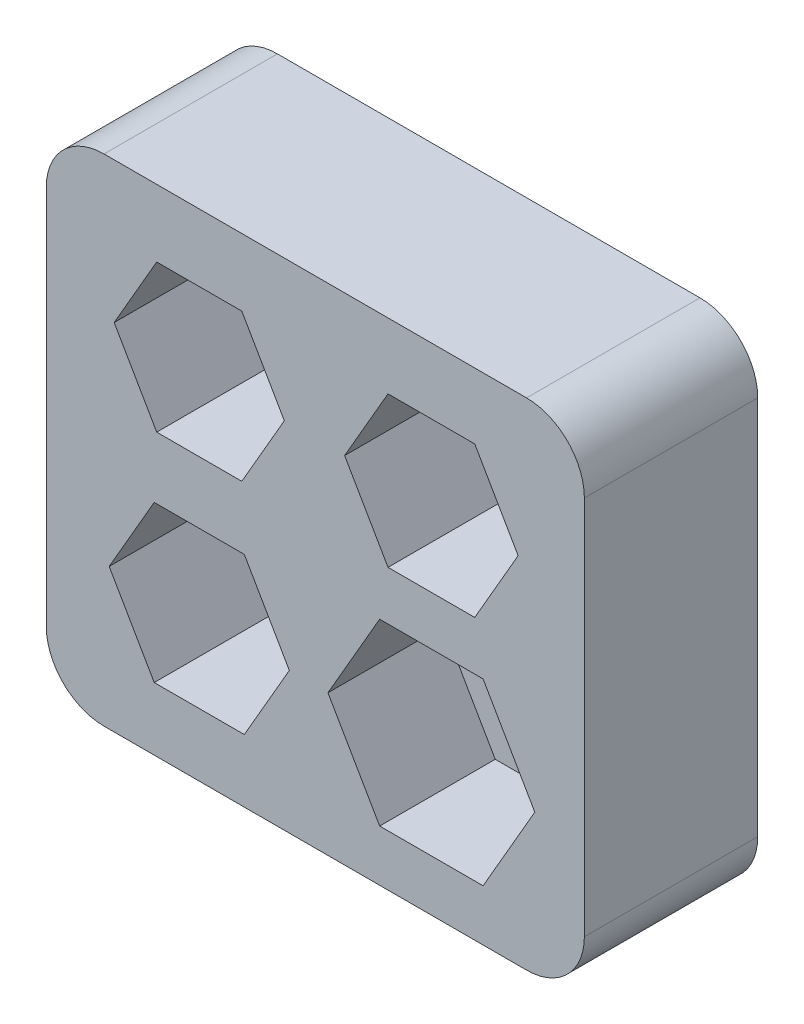
from build123d import *

# Parameters (mm, degrees)
SKETCH1_W           = 9.31161413
SKETCH1_H           = 8.575444948
BOSS_EXTRUDE1_DEPTH = 2
SKETCH2_W           = 9.31161413
SKETCH2_H           = 8.575444948
BOSS_EXTRUDE2_DEPTH = 1
CUT_EXTRUDE1_DEPTH  = 0.5
CUT_EXTRUDE2_DEPTH  = 0.5
FILLET1_R           = 1


with BuildPart() as part:
    # Sketch1 → Boss-Extrude1 (new body)
    with BuildSketch(Plane.XY):
        Rectangle(SKETCH1_W, SKETCH1_H)
        Polygon((-2.744413523, 3.124517886), (-3.480535116, 1.849517886), (-2.744413523, 0.574517886), (-1.272170336, 0.574517886), (-0.536048743, 1.849517886), (-1.272170336, 3.124517886), align=None, mode=Mode.SUBTRACT)
        Polygon((1.25773658, 3.149517886), (0.50718123, 1.849517886), (1.25773658, 0.549517886), (2.75884728, 0.549517886), (3.50940263, 1.849517886), (2.75884728, 3.149517886), align=None, mode=Mode.SUBTRACT)
        Polygon((-2.787714793, -0.499517886), (-3.567137657, -1.849517886), (-2.787714793, -3.199517886), (-1.228869066, -3.199517886), (-0.449446203, -1.849517886), (-1.228869066, -0.499517886), align=None, mode=Mode.SUBTRACT)
        Polygon((1.113399012, -0.299517886), (0.218506095, -1.849517886), (1.113399012, -3.399517886), (2.903184847, -3.399517886), (3.798077764, -1.849517886), (2.903184847, -0.299517886), align=None, mode=Mode.SUBTRACT)
    extrude(amount=BOSS_EXTRUDE1_DEPTH)

    # Sketch2 → Boss-Extrude2 (add)
    with BuildSketch(Plane(origin=(0, 0, 0), x_dir=(-1, 0, 0), z_dir=(0, 0, -1))):
        Rectangle(SKETCH2_W, SKETCH2_H)
    extrude(amount=BOSS_EXTRUDE2_DEPTH)

    # Sketch3 → Cut-Extrude1 (cut)
    # profile 1 of 7: a face of its own
    with BuildSketch(Plane.XY):
        with BuildLine():
            add(Edge.make_bspline(
                [(-2.692073578, 2.099317566), (-2.692026718, 2.107331478), (-2.691935692, 2.122898619), (-2.690923061, 2.145582139), (-2.689240869, 2.166862181), (-2.68693553, 2.186739761), (-2.684130104, 2.205220014), (-2.680385035, 2.22225355), (-2.676126063, 2.237919208), (-2.671189999, 2.252268072), (-2.665620315, 2.265493459), (-2.659558278, 2.277839916), (-2.652763307, 2.289288763), (-2.645623748, 2.300022733), (-2.637850595, 2.309866118), (-2.629665054, 2.318957927), (-2.620747643, 2.327088035), (-2.611401499, 2.334494649), (-2.601542004, 2.340987431), (-2.591450194, 2.346706394), (-2.581056608, 2.351592089), (-2.570332867, 2.35543358), (-2.559375359, 2.358606558), (-2.548145778, 2.360776407), (-2.536625583, 2.36214168), (-2.528849664, 2.362272204), (-2.52490611, 2.362338399)],
                knots=[0, 0, 0, 0, 1.646270934, 3.197905019, 4.663502075, 6.030701355, 7.308322542, 8.50163776, 9.611534131, 10.641858119, 11.616356847, 12.558055219, 13.465016945, 14.349605745, 15.204443733, 16.039544428, 16.859896111, 17.680448484, 18.487036065, 19.28249412, 20.06191084, 20.843045899, 21.620316918, 22.403196591, 23.190181807, 24, 24, 24, 24], degree=3))
            add(Edge.make_bspline(
                [(-2.52490611, 2.362338399), (-2.520929613, 2.362268711), (-2.513021612, 2.362130124), (-2.501330129, 2.360798132), (-2.489908746, 2.358587972), (-2.478806155, 2.355456404), (-2.467931157, 2.351571307), (-2.457368813, 2.346701719), (-2.447053516, 2.34103331), (-2.437149189, 2.334372756), (-2.427547101, 2.326946716), (-2.418483106, 2.318552049), (-2.40995638, 2.309273518), (-2.401859907, 2.299210395), (-2.394423394, 2.288169668), (-2.387341475, 2.276343367), (-2.381002612, 2.263524672), (-2.374897659, 2.249927462), (-2.369628089, 2.235175511), (-2.364875769, 2.219351974), (-2.361035916, 2.202269947), (-2.357837448, 2.184019055), (-2.355359606, 2.164532271), (-2.353554943, 2.143851369), (-2.352601645, 2.121962742), (-2.352422116, 2.106997335), (-2.352329988, 2.099317566)],
                knots=[0, 0, 0, 0, 0.810914788, 1.612654377, 2.396697861, 3.181598691, 3.963628158, 4.749916497, 5.551656086, 6.361998678, 7.18212741, 8.025565596, 8.878627764, 9.750805457, 10.657531673, 11.591944965, 12.560506719, 13.57287815, 14.630710178, 15.753379473, 16.941251878, 18.199788006, 19.531962791, 20.947069417, 22.433333509, 24, 24, 24, 24], degree=3))
            add(Edge.make_bspline(
                [(-2.352329988, 2.099317566), (-2.352423071, 2.091671293), (-2.352604441, 2.076772843), (-2.353544256, 2.054982704), (-2.355395489, 2.034411555), (-2.357711202, 2.01501006), (-2.360918482, 1.996858972), (-2.364862077, 1.979895479), (-2.369240695, 1.964046326), (-2.374645665, 1.949441353), (-2.380561481, 1.935876821), (-2.386997938, 1.923210086), (-2.393893627, 1.911329187), (-2.401406305, 1.900329223), (-2.409413936, 1.890132272), (-2.418087905, 1.880918326), (-2.427183703, 1.872465372), (-2.436814048, 1.864943711), (-2.446872841, 1.858360168), (-2.45715271, 1.852472475), (-2.46783605, 1.847724947), (-2.478680758, 1.843648513), (-2.489841953, 1.840534162), (-2.501305723, 1.838380754), (-2.513013757, 1.83687049), (-2.520928266, 1.836755279), (-2.52490611, 1.836697374)],
                knots=[0, 0, 0, 0, 1.561518951, 3.042555995, 4.452378317, 5.7783523, 7.031515105, 8.214008947, 9.334062868, 10.386615937, 11.391082383, 12.354592575, 13.286541444, 14.194233754, 15.072674879, 15.931287219, 16.775624067, 17.606195743, 18.42308326, 19.229000347, 20.022332153, 20.807536673, 21.593273796, 22.3848459, 23.188221202, 24, 24, 24, 24], degree=3))
            add(Edge.make_bspline(
                [(-2.52490611, 1.836697374), (-2.528849555, 1.836763996), (-2.536625258, 1.836895362), (-2.548147033, 1.838254466), (-2.559330239, 1.840439538), (-2.570230061, 1.843499053), (-2.580902421, 1.84724403), (-2.59120189, 1.852123127), (-2.601242988, 1.85774228), (-2.610998924, 1.864141626), (-2.620286376, 1.871473295), (-2.629157605, 1.879582479), (-2.637389751, 1.888671538), (-2.645051765, 1.898596955), (-2.652333777, 1.909267419), (-2.659032259, 1.920828615), (-2.665228095, 1.933234702), (-2.670891451, 1.946565832), (-2.675912689, 1.961016536), (-2.680348076, 1.976752133), (-2.683850098, 1.99391151), (-2.686847663, 2.012356848), (-2.689265432, 2.032167409), (-2.69091605, 2.053353949), (-2.691936238, 2.075903264), (-2.692026962, 2.091370375), (-2.692073578, 2.099317566)],
                knots=[0, 0, 0, 0, 0.810891512, 1.598919785, 2.382837074, 3.152667961, 3.926044502, 4.706494248, 5.493654104, 6.291793342, 7.103789334, 7.925228297, 8.761435821, 9.622817696, 10.50288917, 11.416980706, 12.369136599, 13.353924996, 14.394355917, 15.514179734, 16.714354668, 17.994756427, 19.357759367, 20.818452758, 22.365282078, 24, 24, 24, 24], degree=3))
        make_face()
        with BuildLine():
            add(Edge.make_bspline(
                [(-2.647201783, 2.099517886), (-2.647184719, 2.092839501), (-2.647151601, 2.079878066), (-2.64628643, 2.061043314), (-2.645107825, 2.043476124), (-2.64358764, 2.027154191), (-2.641330076, 2.01213276), (-2.638800535, 1.99830852), (-2.635722236, 1.985754629), (-2.632080091, 1.974384942), (-2.627931648, 1.964006503), (-2.623402239, 1.954349187), (-2.618536422, 1.94529891), (-2.613090829, 1.936936966), (-2.607160105, 1.929236086), (-2.600878211, 1.922059967), (-2.594010699, 1.915660398), (-2.584510165, 1.907985133), (-2.571967811, 1.900053828), (-2.556164889, 1.893147244), (-2.539926539, 1.888806893), (-2.528904932, 1.888254928), (-2.523403706, 1.887979425)],
                knots=[0, 0, 0, 0, 1.459021318, 2.831673884, 4.118529203, 5.306027144, 6.411944654, 7.436330062, 8.375795394, 9.233974572, 10.042671642, 10.816086306, 11.563610507, 12.285937304, 12.993564865, 13.685989202, 14.367179055, 15.041617293, 16.353048772, 17.594441528, 18.799311195, 20, 20, 20, 20], degree=3))
            add(Edge.make_bspline(
                [(-2.523403706, 1.887979425), (-2.517866896, 1.888207679), (-2.506804707, 1.888663717), (-2.490642736, 1.893063536), (-2.474952697, 1.899702042), (-2.462656706, 1.907551686), (-2.453302057, 1.915027161), (-2.44659963, 1.921400683), (-2.440447908, 1.928537235), (-2.434613326, 1.936237134), (-2.42926203, 1.944647489), (-2.424395867, 1.953727857), (-2.419955389, 1.963503454), (-2.417425525, 1.970327702), (-2.416132071, 1.973816765)],
                knots=[0, 0, 0, 0, 1.353760809, 2.704726607, 4.075137775, 5.516104923, 6.260822281, 7.007110065, 7.778089737, 8.566572457, 9.372053459, 10.217411131, 11.088608312, 12, 12, 12, 12], degree=3))
            add(Edge.make_bspline(
                [(-2.416132071, 1.973816765), (-2.414624676, 1.978278156), (-2.411564017, 1.987336694), (-2.407619478, 2.001388644), (-2.404512992, 2.016131896), (-2.401718225, 2.031478341), (-2.399810646, 2.047541156), (-2.398275244, 2.064270639), (-2.39737086, 2.081679405), (-2.397258753, 2.093507261), (-2.397201783, 2.099517886)],
                knots=[0, 0, 0, 0, 0.884706709, 1.796334032, 2.740027952, 3.714592787, 4.726048262, 5.777819803, 6.87074269, 8, 8, 8, 8], degree=3))
            add(Edge.make_bspline(
                [(-2.397201783, 2.099517886), (-2.397280381, 2.10552754), (-2.397434137, 2.117283706), (-2.398021849, 2.134500589), (-2.399539503, 2.150853126), (-2.401225091, 2.166411765), (-2.403710408, 2.18109038), (-2.406390095, 2.195011852), (-2.409990268, 2.208003713), (-2.41383595, 2.220269367), (-2.418237435, 2.231669461), (-2.42308254, 2.242257145), (-2.428257077, 2.252083534), (-2.433877397, 2.261121668), (-2.439876781, 2.269412032), (-2.446413573, 2.276788402), (-2.453228484, 2.283479398), (-2.462773796, 2.291116908), (-2.475270123, 2.298904293), (-2.490819501, 2.30607083), (-2.507001022, 2.3101863), (-2.517940087, 2.310766541), (-2.523403706, 2.311056348)],
                knots=[0, 0, 0, 0, 1.31362396, 2.569729283, 3.763502607, 4.902122613, 5.988968491, 7.01645872, 7.998833611, 8.933434873, 9.825090667, 10.667526885, 11.477055099, 12.250526234, 12.991942729, 13.710640831, 14.402115721, 15.076753259, 16.378508321, 17.609869233, 18.806226677, 20, 20, 20, 20], degree=3))
            add(Edge.make_bspline(
                [(-2.523403706, 2.311056348), (-2.52893379, 2.310766141), (-2.540004034, 2.310185199), (-2.556353742, 2.306086163), (-2.572025792, 2.298941454), (-2.584489074, 2.291091115), (-2.594041044, 2.283614213), (-2.600767143, 2.277130434), (-2.607073739, 2.270038112), (-2.61288341, 2.26226641), (-2.618324736, 2.253914214), (-2.623322024, 2.244915819), (-2.6278245, 2.235225625), (-2.631979433, 2.224851848), (-2.635632689, 2.213483142), (-2.638646112, 2.200944714), (-2.641429977, 2.187164444), (-2.64340073, 2.172061657), (-2.645152695, 2.155735635), (-2.646278602, 2.13812459), (-2.647154495, 2.11925825), (-2.647185705, 2.106229798), (-2.647201783, 2.099517886)],
                knots=[0, 0, 0, 0, 1.207732386, 2.417664972, 3.655092373, 4.956220595, 5.625982001, 6.301752483, 6.994047911, 7.697131622, 8.419323945, 9.170223765, 9.943494443, 10.752040957, 11.610060368, 12.549350801, 13.567764191, 14.679664412, 15.874934091, 17.154273443, 18.533957287, 20, 20, 20, 20], degree=3))
        make_face(mode=Mode.SUBTRACT)
    # profile 2 of 7: a face of its own
    with BuildSketch(Plane.XY):
        Polygon((-2.231536719, 1.939261476), (-2.185663321, 1.917025899), (-2.254573578, 1.785415322), (-2.288227424, 1.80003872), align=None)
    # profile 3 of 7: a face of its own
    with BuildSketch(Plane.XY):
        with BuildLine():
            add(Edge.make_bspline(
                [(-2.121560757, 2.099317566), (-2.121513897, 2.107331478), (-2.121422872, 2.122898619), (-2.12041024, 2.145582139), (-2.118728048, 2.166862181), (-2.116422709, 2.186739761), (-2.113617284, 2.205220014), (-2.109872214, 2.22225355), (-2.105613242, 2.237919208), (-2.100677179, 2.252268072), (-2.095107495, 2.265493459), (-2.089045457, 2.277839916), (-2.082250487, 2.289288763), (-2.075110928, 2.300022733), (-2.067337775, 2.309866118), (-2.059152233, 2.318957927), (-2.050234822, 2.327088035), (-2.040888678, 2.334494649), (-2.031029183, 2.340987431), (-2.020937374, 2.346706394), (-2.010543787, 2.351592089), (-1.999820047, 2.35543358), (-1.988862539, 2.358606558), (-1.977632958, 2.360776407), (-1.966112763, 2.36214168), (-1.958336843, 2.362272204), (-1.954393289, 2.362338399)],
                knots=[0, 0, 0, 0, 1.646270934, 3.197905019, 4.663502075, 6.030701355, 7.308322542, 8.50163776, 9.611534131, 10.641858119, 11.616356847, 12.558055219, 13.465016945, 14.349605745, 15.204443733, 16.039544428, 16.859896111, 17.680448484, 18.487036065, 19.28249412, 20.06191084, 20.843045899, 21.620316918, 22.403196591, 23.190181807, 24, 24, 24, 24], degree=3))
            add(Edge.make_bspline(
                [(-1.954393289, 2.362338399), (-1.950416792, 2.362268711), (-1.942508791, 2.362130124), (-1.930817309, 2.360798132), (-1.919395926, 2.358587972), (-1.908293334, 2.355456404), (-1.897418336, 2.351571307), (-1.886855992, 2.346701719), (-1.876540695, 2.34103331), (-1.866636368, 2.334372756), (-1.85703428, 2.326946716), (-1.847970286, 2.318552049), (-1.839443559, 2.309273518), (-1.831347087, 2.299210395), (-1.823910573, 2.288169668), (-1.816828654, 2.276343367), (-1.810489792, 2.263524672), (-1.804384838, 2.249927462), (-1.799115269, 2.235175511), (-1.794362948, 2.219351974), (-1.790523095, 2.202269947), (-1.787324628, 2.184019055), (-1.784846786, 2.164532271), (-1.783042122, 2.143851369), (-1.782088825, 2.121962742), (-1.781909296, 2.106997335), (-1.781817167, 2.099317566)],
                knots=[0, 0, 0, 0, 0.810914788, 1.612654377, 2.396697861, 3.181598691, 3.963628158, 4.749916497, 5.551656086, 6.361998678, 7.18212741, 8.025565596, 8.878627764, 9.750805457, 10.657531673, 11.591944965, 12.560506719, 13.57287815, 14.630710178, 15.753379473, 16.941251878, 18.199788006, 19.531962791, 20.947069417, 22.433333509, 24, 24, 24, 24], degree=3))
            add(Edge.make_bspline(
                [(-1.781817167, 2.099317566), (-1.781910251, 2.091671293), (-1.78209162, 2.076772843), (-1.783031436, 2.054982704), (-1.784882669, 2.034411555), (-1.787198381, 2.01501006), (-1.790405662, 1.996858972), (-1.794349257, 1.979895479), (-1.798727874, 1.964046326), (-1.804132845, 1.949441353), (-1.810048661, 1.935876821), (-1.816485117, 1.923210086), (-1.823380807, 1.911329187), (-1.830893485, 1.900329223), (-1.838901115, 1.890132272), (-1.847575085, 1.880918326), (-1.856670883, 1.872465372), (-1.866301228, 1.864943711), (-1.876360021, 1.858360168), (-1.886639889, 1.852472475), (-1.89732323, 1.847724947), (-1.908167937, 1.843648513), (-1.919329132, 1.840534162), (-1.930792902, 1.838380754), (-1.942500936, 1.83687049), (-1.950415445, 1.836755279), (-1.954393289, 1.836697374)],
                knots=[0, 0, 0, 0, 1.561518951, 3.042555995, 4.452378317, 5.7783523, 7.031515105, 8.214008947, 9.334062868, 10.386615937, 11.391082383, 12.354592575, 13.286541444, 14.194233754, 15.072674879, 15.931287219, 16.775624067, 17.606195743, 18.42308326, 19.229000347, 20.022332153, 20.807536673, 21.593273796, 22.3848459, 23.188221202, 24, 24, 24, 24], degree=3))
            add(Edge.make_bspline(
                [(-1.954393289, 1.836697374), (-1.958336734, 1.836763996), (-1.966112438, 1.836895362), (-1.977634213, 1.838254466), (-1.988817419, 1.840439538), (-1.999717241, 1.843499053), (-2.0103896, 1.84724403), (-2.02068907, 1.852123127), (-2.030730167, 1.85774228), (-2.040486104, 1.864141626), (-2.049773556, 1.871473295), (-2.058644785, 1.879582479), (-2.06687693, 1.888671538), (-2.074538944, 1.898596955), (-2.081820957, 1.909267419), (-2.088519439, 1.920828615), (-2.094715275, 1.933234702), (-2.100378631, 1.946565832), (-2.105399868, 1.961016536), (-2.109835255, 1.976752133), (-2.113337278, 1.99391151), (-2.116334843, 2.012356848), (-2.118752612, 2.032167409), (-2.12040323, 2.053353949), (-2.121423418, 2.075903264), (-2.121514142, 2.091370375), (-2.121560757, 2.099317566)],
                knots=[0, 0, 0, 0, 0.810891512, 1.598919785, 2.382837074, 3.152667961, 3.926044502, 4.706494248, 5.493654104, 6.291793342, 7.103789334, 7.925228297, 8.761435821, 9.622817696, 10.50288917, 11.416980706, 12.369136599, 13.353924996, 14.394355917, 15.514179734, 16.714354668, 17.994756427, 19.357759367, 20.818452758, 22.365282078, 24, 24, 24, 24], degree=3))
        make_face()
        with BuildLine():
            add(Edge.make_bspline(
                [(-2.076688962, 2.099517886), (-2.076671898, 2.092839501), (-2.076638781, 2.079878066), (-2.075773609, 2.061043314), (-2.074595005, 2.043476124), (-2.073074819, 2.027154191), (-2.070817255, 2.01213276), (-2.068287714, 1.99830852), (-2.065209416, 1.985754629), (-2.06156727, 1.974384942), (-2.057418828, 1.964006503), (-2.052889419, 1.954349187), (-2.048023601, 1.94529891), (-2.042578008, 1.936936966), (-2.036647285, 1.929236086), (-2.030365391, 1.922059967), (-2.023497879, 1.915660398), (-2.013997344, 1.907985133), (-2.001454991, 1.900053828), (-1.985652068, 1.893147244), (-1.969413718, 1.888806893), (-1.958392111, 1.888254928), (-1.952890885, 1.887979425)],
                knots=[0, 0, 0, 0, 1.459021318, 2.831673884, 4.118529203, 5.306027144, 6.411944654, 7.436330062, 8.375795394, 9.233974572, 10.042671642, 10.816086306, 11.563610507, 12.285937304, 12.993564865, 13.685989202, 14.367179055, 15.041617293, 16.353048772, 17.594441528, 18.799311195, 20, 20, 20, 20], degree=3))
            add(Edge.make_bspline(
                [(-1.952890885, 1.887979425), (-1.947354075, 1.888207679), (-1.936291886, 1.888663717), (-1.920129915, 1.893063536), (-1.904439877, 1.899702042), (-1.892143885, 1.907551686), (-1.882789236, 1.915027161), (-1.876086809, 1.921400683), (-1.869935088, 1.928537235), (-1.864100506, 1.936237134), (-1.858749209, 1.944647489), (-1.853883047, 1.953727857), (-1.849442568, 1.963503454), (-1.846912705, 1.970327702), (-1.845619251, 1.973816765)],
                knots=[0, 0, 0, 0, 1.353760809, 2.704726607, 4.075137775, 5.516104923, 6.260822281, 7.007110065, 7.778089737, 8.566572457, 9.372053459, 10.217411131, 11.088608312, 12, 12, 12, 12], degree=3))
            add(Edge.make_bspline(
                [(-1.845619251, 1.973816765), (-1.844111855, 1.978278156), (-1.841051196, 1.987336694), (-1.837106657, 2.001388644), (-1.834000171, 2.016131896), (-1.831205405, 2.031478341), (-1.829297826, 2.047541156), (-1.827762424, 2.064270639), (-1.82685804, 2.081679405), (-1.826745932, 2.093507261), (-1.826688962, 2.099517886)],
                knots=[0, 0, 0, 0, 0.884706709, 1.796334032, 2.740027952, 3.714592787, 4.726048262, 5.777819803, 6.87074269, 8, 8, 8, 8], degree=3))
            add(Edge.make_bspline(
                [(-1.826688962, 2.099517886), (-1.826767561, 2.10552754), (-1.826921316, 2.117283706), (-1.827509029, 2.134500589), (-1.829026682, 2.150853126), (-1.830712271, 2.166411765), (-1.833197588, 2.18109038), (-1.835877275, 2.195011852), (-1.839477448, 2.208003713), (-1.84332313, 2.220269367), (-1.847724615, 2.231669461), (-1.85256972, 2.242257145), (-1.857744257, 2.252083534), (-1.863364577, 2.261121668), (-1.86936396, 2.269412032), (-1.875900753, 2.276788402), (-1.882715663, 2.283479398), (-1.892260976, 2.291116908), (-1.904757303, 2.298904293), (-1.920306681, 2.30607083), (-1.936488202, 2.3101863), (-1.947427266, 2.310766541), (-1.952890885, 2.311056348)],
                knots=[0, 0, 0, 0, 1.31362396, 2.569729283, 3.763502607, 4.902122613, 5.988968491, 7.01645872, 7.998833611, 8.933434873, 9.825090667, 10.667526885, 11.477055099, 12.250526234, 12.991942729, 13.710640831, 14.402115721, 15.076753259, 16.378508321, 17.609869233, 18.806226677, 20, 20, 20, 20], degree=3))
            add(Edge.make_bspline(
                [(-1.952890885, 2.311056348), (-1.95842097, 2.310766141), (-1.969491214, 2.310185199), (-1.985840921, 2.306086163), (-2.001512972, 2.298941454), (-2.013976254, 2.291091115), (-2.023528223, 2.283614213), (-2.030254322, 2.277130434), (-2.036560918, 2.270038112), (-2.04237059, 2.26226641), (-2.047811916, 2.253914214), (-2.052809203, 2.244915819), (-2.057311679, 2.235225625), (-2.061466613, 2.224851848), (-2.065119868, 2.213483142), (-2.068133292, 2.200944714), (-2.070917156, 2.187164444), (-2.072887909, 2.172061657), (-2.074639874, 2.155735635), (-2.075765781, 2.13812459), (-2.076641675, 2.11925825), (-2.076672884, 2.106229798), (-2.076688962, 2.099517886)],
                knots=[0, 0, 0, 0, 1.207732386, 2.417664972, 3.655092373, 4.956220595, 5.625982001, 6.301752483, 6.994047911, 7.697131622, 8.419323945, 9.170223765, 9.943494443, 10.752040957, 11.610060368, 12.549350801, 13.567764191, 14.679664412, 15.874934091, 17.154273443, 18.533957287, 20, 20, 20, 20], degree=3))
        make_face(mode=Mode.SUBTRACT)
    # profile 4 of 7: a face of its own
    with BuildSketch(Plane.XY):
        with BuildLine():
            Line((-1.422842808, 2.349517886), (-1.422842808, 2.298235835))
            Line((-1.422842808, 2.298235835), (-1.592914924, 2.298235835))
            Line((-1.592914924, 2.298235835), (-1.619858033, 2.166725418))
            add(Edge.make_bspline(
                [(-1.619858033, 2.166725418), (-1.614564336, 2.168186886), (-1.604308637, 2.171018248), (-1.589171514, 2.174161929), (-1.574801199, 2.176056993), (-1.565476146, 2.176315751), (-1.560963802, 2.176440963)],
                knots=[0, 0, 0, 0, 1.100273476, 2.13160584, 3.095893838, 4, 4, 4, 4], degree=3))
            add(Edge.make_bspline(
                [(-1.560963802, 2.176440963), (-1.555380411, 2.176320115), (-1.544402068, 2.176082498), (-1.528339361, 2.173800805), (-1.513006091, 2.170209389), (-1.498434324, 2.165192172), (-1.484597102, 2.158776495), (-1.471621736, 2.150762218), (-1.459313463, 2.141400314), (-1.447893093, 2.130636741), (-1.437532477, 2.118790795), (-1.42842305, 2.106053957), (-1.420685537, 2.092550005), (-1.414462572, 2.078149918), (-1.409493382, 2.063012896), (-1.406185954, 2.04697967), (-1.403983567, 2.030201367), (-1.403737511, 2.018729286), (-1.403612039, 2.012879265)],
                knots=[0, 0, 0, 0, 1.052922333, 2.070308379, 3.05430497, 4.020497103, 4.973039431, 5.925935799, 6.892292201, 7.88610001, 8.88166317, 9.857072816, 10.836096531, 11.812156883, 12.81219415, 13.836441305, 14.89672472, 16, 16, 16, 16], degree=3))
            add(Edge.make_bspline(
                [(-1.403612039, 2.012879265), (-1.40370705, 2.008804662), (-1.403895787, 2.000710521), (-1.404855586, 1.988689921), (-1.406703545, 1.976923802), (-1.409184649, 1.965410603), (-1.412404994, 1.954172121), (-1.41630343, 1.943176188), (-1.421074291, 1.932491245), (-1.426307345, 1.922016188), (-1.432199699, 1.91198783), (-1.438739486, 1.902609403), (-1.445648842, 1.89374022), (-1.453083325, 1.885475401), (-1.461112039, 1.877869256), (-1.469637748, 1.870876644), (-1.478592423, 1.864379311), (-1.4881146, 1.858640998), (-1.497992098, 1.853360575), (-1.508367557, 1.849028641), (-1.5190048, 1.845155709), (-1.530056925, 1.842068634), (-1.541498898, 1.839649697), (-1.553349581, 1.838006754), (-1.565546819, 1.83681012), (-1.573814678, 1.836735212), (-1.577991046, 1.836697374)],
                knots=[0, 0, 0, 0, 1.056347294, 2.098418968, 3.122841568, 4.141288669, 5.149314143, 6.15115421, 7.162517403, 8.180376062, 9.185164535, 10.17417709, 11.141909838, 12.097768115, 13.052685741, 14.0056014, 14.954263652, 15.917497458, 16.885230207, 17.854509472, 18.828990115, 19.81800267, 20.826176721, 21.857883937, 22.917946725, 24, 24, 24, 24], degree=3))
            add(Edge.make_bspline(
                [(-1.577991046, 1.836697374), (-1.582973071, 1.836796065), (-1.592774619, 1.836990228), (-1.6071347, 1.83902144), (-1.620951072, 1.841930571), (-1.634112515, 1.846307181), (-1.646736981, 1.85179108), (-1.658654512, 1.858721962), (-1.670169623, 1.86657612), (-1.6808142, 1.875844741), (-1.690693645, 1.885975553), (-1.699537432, 1.896969502), (-1.707413657, 1.908645136), (-1.714196192, 1.921059158), (-1.719981624, 1.934178949), (-1.724526622, 1.948053663), (-1.728194959, 1.962610806), (-1.729746876, 1.972632736), (-1.730535116, 1.977723015)],
                knots=[0, 0, 0, 0, 1.0467383, 2.05933395, 3.04377827, 4.011590433, 4.970194871, 5.932262533, 6.905835911, 7.896367577, 8.894135286, 9.877477877, 10.858688626, 11.851381753, 12.8477658, 13.868841284, 14.917554742, 16, 16, 16, 16], degree=3))
            Line((-1.730535116, 1.977723015), (-1.685663321, 1.977723015))
            add(Edge.make_bspline(
                [(-1.685663321, 1.977723015), (-1.684559242, 1.97295495), (-1.682437139, 1.963790465), (-1.677779175, 1.950914559), (-1.67208405, 1.939440384), (-1.665312, 1.929216158), (-1.657233425, 1.920300587), (-1.648014935, 1.912355292), (-1.637679546, 1.905187417), (-1.626194799, 1.899212736), (-1.614078644, 1.8941172), (-1.601397614, 1.8907241), (-1.588496993, 1.888338259), (-1.579771512, 1.888099436), (-1.575386879, 1.887979425)],
                knots=[0, 0, 0, 0, 1.136247022, 2.183929868, 3.172523383, 4.106158343, 5.02341133, 5.958108904, 6.928429099, 7.938127109, 8.96079061, 9.975095812, 10.982467395, 12, 12, 12, 12], degree=3))
            add(Edge.make_bspline(
                [(-1.575386879, 1.887979425), (-1.571107101, 1.888096679), (-1.562680184, 1.888327553), (-1.550278557, 1.890104555), (-1.538305289, 1.892841351), (-1.526878524, 1.896937044), (-1.515798304, 1.901914861), (-1.505344908, 1.908302729), (-1.495215926, 1.91565416), (-1.485726193, 1.924076536), (-1.477034843, 1.933357921), (-1.469355397, 1.943283263), (-1.462958695, 1.953871384), (-1.457568108, 1.964938977), (-1.453474779, 1.976607342), (-1.450554639, 1.988821796), (-1.448839917, 2.001612507), (-1.448604034, 2.010336694), (-1.448483834, 2.014782309)],
                knots=[0, 0, 0, 0, 1.027316725, 2.022795036, 3.002884548, 3.971462791, 4.93288096, 5.914575861, 6.907176829, 7.935150275, 8.956128384, 9.956726525, 10.942570165, 11.921478529, 12.907843606, 13.90538589, 14.932640048, 16, 16, 16, 16], degree=3))
            add(Edge.make_bspline(
                [(-1.448483834, 2.014782309), (-1.448577903, 2.018793131), (-1.448762028, 2.026643744), (-1.450266395, 2.038129345), (-1.452883106, 2.048996922), (-1.456515089, 2.059298956), (-1.461126447, 2.069045162), (-1.466761634, 2.078245599), (-1.473526406, 2.086779004), (-1.481253818, 2.094649368), (-1.489719253, 2.101912922), (-1.499068359, 2.108104934), (-1.509105491, 2.113314065), (-1.51970972, 2.117809494), (-1.531133277, 2.121038172), (-1.543149938, 2.123462155), (-1.555889468, 2.12486435), (-1.564599566, 2.125058905), (-1.569076783, 2.125158912)],
                knots=[0, 0, 0, 0, 1.045622112, 2.046656509, 3.013763289, 3.955457236, 4.890082067, 5.820317437, 6.762574623, 7.722996705, 8.69280354, 9.665887285, 10.63943826, 11.638615906, 12.663482002, 13.728887084, 14.832589034, 16, 16, 16, 16], degree=3))
            add(Edge.make_bspline(
                [(-1.569076783, 2.125158912), (-1.572952344, 2.12507597), (-1.580954395, 2.124904717), (-1.593229084, 2.123643789), (-1.606127902, 2.121609604), (-1.619601401, 2.118811569), (-1.633690045, 2.115149986), (-1.648364103, 2.110762201), (-1.663654426, 2.105516201), (-1.673956958, 2.101554456), (-1.679253065, 2.099517886)],
                knots=[0, 0, 0, 0, 0.817624296, 1.688186739, 2.600797293, 3.572016777, 4.590301741, 5.671205678, 6.80286297, 8, 8, 8, 8], degree=3))
            Line((-1.679253065, 2.099517886), (-1.627971014, 2.349517886))
            Line((-1.627971014, 2.349517886), (-1.422842808, 2.349517886))
        make_face()
    # profile 5 of 7: a face of its own
    with BuildSketch(Plane.XY):
        with BuildLine():
            add(Edge.make_bspline(
                [(1.532285397, 2.099317566), (1.532332256, 2.107331478), (1.532423282, 2.122898619), (1.533435914, 2.145582139), (1.535118105, 2.166862181), (1.537423444, 2.186739761), (1.54022887, 2.205220014), (1.54397394, 2.22225355), (1.548232911, 2.237919208), (1.553168975, 2.252268072), (1.558738659, 2.265493459), (1.564800697, 2.277839916), (1.571595667, 2.289288763), (1.578735226, 2.300022733), (1.586508379, 2.309866118), (1.594693921, 2.318957927), (1.603611332, 2.327088035), (1.612957476, 2.334494649), (1.622816971, 2.340987431), (1.63290878, 2.346706394), (1.643302367, 2.351592089), (1.654026107, 2.35543358), (1.664983615, 2.358606558), (1.676213196, 2.360776407), (1.687733391, 2.36214168), (1.69550931, 2.362272204), (1.699452865, 2.362338399)],
                knots=[0, 0, 0, 0, 1.646270934, 3.197905019, 4.663502075, 6.030701355, 7.308322542, 8.50163776, 9.611534131, 10.641858119, 11.616356847, 12.558055219, 13.465016945, 14.349605745, 15.204443733, 16.039544428, 16.859896111, 17.680448484, 18.487036065, 19.28249412, 20.06191084, 20.843045899, 21.620316918, 22.403196591, 23.190181807, 24, 24, 24, 24], degree=3))
            add(Edge.make_bspline(
                [(1.699452865, 2.362338399), (1.703429362, 2.362268711), (1.711337363, 2.362130124), (1.723028845, 2.360798132), (1.734450228, 2.358587972), (1.745552819, 2.355456404), (1.756427817, 2.351571307), (1.766990161, 2.346701719), (1.777305459, 2.34103331), (1.787209786, 2.334372756), (1.796811873, 2.326946716), (1.805875868, 2.318552049), (1.814402595, 2.309273518), (1.822499067, 2.299210395), (1.829935581, 2.288169668), (1.8370175, 2.276343367), (1.843356362, 2.263524672), (1.849461316, 2.249927462), (1.854730885, 2.235175511), (1.859483206, 2.219351974), (1.863323058, 2.202269947), (1.866521526, 2.184019055), (1.868999368, 2.164532271), (1.870804031, 2.143851369), (1.871757329, 2.121962742), (1.871936858, 2.106997335), (1.872028986, 2.099317566)],
                knots=[0, 0, 0, 0, 0.810914788, 1.612654377, 2.396697861, 3.181598691, 3.963628158, 4.749916497, 5.551656086, 6.361998678, 7.18212741, 8.025565596, 8.878627764, 9.750805457, 10.657531673, 11.591944965, 12.560506719, 13.57287815, 14.630710178, 15.753379473, 16.941251878, 18.199788006, 19.531962791, 20.947069417, 22.433333509, 24, 24, 24, 24], degree=3))
            add(Edge.make_bspline(
                [(1.872028986, 2.099317566), (1.871935903, 2.091671293), (1.871754533, 2.076772843), (1.870814718, 2.054982704), (1.868963485, 2.034411555), (1.866647773, 2.01501006), (1.863440492, 1.996858972), (1.859496897, 1.979895479), (1.855118279, 1.964046326), (1.849713309, 1.949441353), (1.843797493, 1.935876821), (1.837361037, 1.923210086), (1.830465347, 1.911329187), (1.822952669, 1.900329223), (1.814945039, 1.890132272), (1.806271069, 1.880918326), (1.797175271, 1.872465372), (1.787544926, 1.864943711), (1.777486133, 1.858360168), (1.767206265, 1.852472475), (1.756522924, 1.847724947), (1.745678217, 1.843648513), (1.734517022, 1.840534162), (1.723053252, 1.838380754), (1.711345218, 1.83687049), (1.703430708, 1.836755279), (1.699452865, 1.836697374)],
                knots=[0, 0, 0, 0, 1.561518951, 3.042555995, 4.452378317, 5.7783523, 7.031515105, 8.214008947, 9.334062868, 10.386615937, 11.391082383, 12.354592575, 13.286541444, 14.194233754, 15.072674879, 15.931287219, 16.775624067, 17.606195743, 18.42308326, 19.229000347, 20.022332153, 20.807536673, 21.593273796, 22.3848459, 23.188221202, 24, 24, 24, 24], degree=3))
            add(Edge.make_bspline(
                [(1.699452865, 1.836697374), (1.69550942, 1.836763996), (1.687733716, 1.836895362), (1.676211941, 1.838254466), (1.665028735, 1.840439538), (1.654128913, 1.843499053), (1.643456554, 1.84724403), (1.633157084, 1.852123127), (1.623115986, 1.85774228), (1.61336005, 1.864141626), (1.604072598, 1.871473295), (1.595201369, 1.879582479), (1.586969223, 1.888671538), (1.57930721, 1.898596955), (1.572025197, 1.909267419), (1.565326715, 1.920828615), (1.559130879, 1.933234702), (1.553467523, 1.946565832), (1.548446285, 1.961016536), (1.544010899, 1.976752133), (1.540508876, 1.99391151), (1.537511311, 2.012356848), (1.535093542, 2.032167409), (1.533442924, 2.053353949), (1.532422736, 2.075903264), (1.532332012, 2.091370375), (1.532285397, 2.099317566)],
                knots=[0, 0, 0, 0, 0.810891512, 1.598919785, 2.382837074, 3.152667961, 3.926044502, 4.706494248, 5.493654104, 6.291793342, 7.103789334, 7.925228297, 8.761435821, 9.622817696, 10.50288917, 11.416980706, 12.369136599, 13.353924996, 14.394355917, 15.514179734, 16.714354668, 17.994756427, 19.357759367, 20.818452758, 22.365282078, 24, 24, 24, 24], degree=3))
        make_face()
        with BuildLine():
            add(Edge.make_bspline(
                [(1.577157192, 2.099517886), (1.577174255, 2.092839501), (1.577207373, 2.079878066), (1.578072545, 2.061043314), (1.579251149, 2.043476124), (1.580771334, 2.027154191), (1.583028899, 2.01213276), (1.58555844, 1.99830852), (1.588636738, 1.985754629), (1.592278884, 1.974384942), (1.596427326, 1.964006503), (1.600956735, 1.954349187), (1.605822553, 1.94529891), (1.611268146, 1.936936966), (1.617198869, 1.929236086), (1.623480763, 1.922059967), (1.630348275, 1.915660398), (1.63984881, 1.907985133), (1.652391163, 1.900053828), (1.668194085, 1.893147244), (1.684432436, 1.888806893), (1.695454043, 1.888254928), (1.700955268, 1.887979425)],
                knots=[0, 0, 0, 0, 1.459021318, 2.831673884, 4.118529203, 5.306027144, 6.411944654, 7.436330062, 8.375795394, 9.233974572, 10.042671642, 10.816086306, 11.563610507, 12.285937304, 12.993564865, 13.685989202, 14.367179055, 15.041617293, 16.353048772, 17.594441528, 18.799311195, 20, 20, 20, 20], degree=3))
            add(Edge.make_bspline(
                [(1.700955268, 1.887979425), (1.706492079, 1.888207679), (1.717554268, 1.888663717), (1.733716238, 1.893063536), (1.749406277, 1.899702042), (1.761702269, 1.907551686), (1.771056918, 1.915027161), (1.777759345, 1.921400683), (1.783911066, 1.928537235), (1.789745648, 1.936237134), (1.795096945, 1.944647489), (1.799963107, 1.953727857), (1.804403585, 1.963503454), (1.806933449, 1.970327702), (1.808226903, 1.973816765)],
                knots=[0, 0, 0, 0, 1.353760809, 2.704726607, 4.075137775, 5.516104923, 6.260822281, 7.007110065, 7.778089737, 8.566572457, 9.372053459, 10.217411131, 11.088608312, 12, 12, 12, 12], degree=3))
            add(Edge.make_bspline(
                [(1.808226903, 1.973816765), (1.809734298, 1.978278156), (1.812794958, 1.987336694), (1.816739497, 2.001388644), (1.819845982, 2.016131896), (1.822640749, 2.031478341), (1.824548328, 2.047541156), (1.82608373, 2.064270639), (1.826988114, 2.081679405), (1.827100221, 2.093507261), (1.827157192, 2.099517886)],
                knots=[0, 0, 0, 0, 0.884706709, 1.796334032, 2.740027952, 3.714592787, 4.726048262, 5.777819803, 6.87074269, 8, 8, 8, 8], degree=3))
            add(Edge.make_bspline(
                [(1.827157192, 2.099517886), (1.827078593, 2.10552754), (1.826924838, 2.117283706), (1.826337125, 2.134500589), (1.824819472, 2.150853126), (1.823133883, 2.166411765), (1.820648566, 2.18109038), (1.817968879, 2.195011852), (1.814368706, 2.208003713), (1.810523024, 2.220269367), (1.806121539, 2.231669461), (1.801276434, 2.242257145), (1.796101897, 2.252083534), (1.790481577, 2.261121668), (1.784482194, 2.269412032), (1.777945401, 2.276788402), (1.77113049, 2.283479398), (1.761585178, 2.291116908), (1.749088851, 2.298904293), (1.733539473, 2.30607083), (1.717357952, 2.3101863), (1.706418887, 2.310766541), (1.700955268, 2.311056348)],
                knots=[0, 0, 0, 0, 1.31362396, 2.569729283, 3.763502607, 4.902122613, 5.988968491, 7.01645872, 7.998833611, 8.933434873, 9.825090667, 10.667526885, 11.477055099, 12.250526234, 12.991942729, 13.710640831, 14.402115721, 15.076753259, 16.378508321, 17.609869233, 18.806226677, 20, 20, 20, 20], degree=3))
            add(Edge.make_bspline(
                [(1.700955268, 2.311056348), (1.695425184, 2.310766141), (1.68435494, 2.310185199), (1.668005232, 2.306086163), (1.652333182, 2.298941454), (1.6398699, 2.291091115), (1.630317931, 2.283614213), (1.623591832, 2.277130434), (1.617285235, 2.270038112), (1.611475564, 2.26226641), (1.606034238, 2.253914214), (1.60103695, 2.244915819), (1.596534475, 2.235225625), (1.592379541, 2.224851848), (1.588726286, 2.213483142), (1.585712862, 2.200944714), (1.582928997, 2.187164444), (1.580958245, 2.172061657), (1.57920628, 2.155735635), (1.578080373, 2.13812459), (1.577204479, 2.11925825), (1.57717327, 2.106229798), (1.577157192, 2.099517886)],
                knots=[0, 0, 0, 0, 1.207732386, 2.417664972, 3.655092373, 4.956220595, 5.625982001, 6.301752483, 6.994047911, 7.697131622, 8.419323945, 9.170223765, 9.943494443, 10.752040957, 11.610060368, 12.549350801, 13.567764191, 14.679664412, 15.874934091, 17.154273443, 18.533957287, 20, 20, 20, 20], degree=3))
        make_face(mode=Mode.SUBTRACT)
    # profile 6 of 7: a face of its own
    with BuildSketch(Plane.XY):
        Polygon((1.992822256, 1.939261476), (2.038695653, 1.917025899), (1.969785397, 1.785415322), (1.936131551, 1.80003872), align=None)
    # profile 7 of 7: a face of its own
    with BuildSketch(Plane.XY):
        Polygon((2.209068249, 2.349517886), (2.301516166, 2.349517886), (2.301516166, 1.849517886), (2.256644371, 1.849517886), (2.256644371, 2.298235835), (2.179721294, 2.298235835), align=None)
    extrude(amount=-CUT_EXTRUDE1_DEPTH, mode=Mode.SUBTRACT)

    # Sketch4 → Cut-Extrude2 (cut)
    # profile 1 of 6: a face of its own
    with BuildSketch(Plane.XY):
        with BuildLine():
            add(Edge.make_bspline(
                [(-2.580933107, -1.609132456), (-2.580886247, -1.601118543), (-2.580795221, -1.585551403), (-2.579782589, -1.562867883), (-2.578100398, -1.541587841), (-2.575795059, -1.52171026), (-2.572989633, -1.503230008), (-2.569244563, -1.486196472), (-2.564985592, -1.470530814), (-2.560049528, -1.456181949), (-2.554479844, -1.442956563), (-2.548417807, -1.430610106), (-2.541622836, -1.419161259), (-2.534483277, -1.408427288), (-2.526710124, -1.398583903), (-2.518524582, -1.389492095), (-2.509607172, -1.381361987), (-2.500261027, -1.373955373), (-2.490401533, -1.367462591), (-2.480309723, -1.361743628), (-2.469916137, -1.356857933), (-2.459192396, -1.353016442), (-2.448234888, -1.349843464), (-2.437005307, -1.347673614), (-2.425485112, -1.346308342), (-2.417709193, -1.346177818), (-2.413765639, -1.346111623)],
                knots=[0, 0, 0, 0, 1.646270934, 3.197905019, 4.663502075, 6.030701355, 7.308322542, 8.50163776, 9.611534131, 10.641858119, 11.616356847, 12.558055219, 13.465016945, 14.349605745, 15.204443733, 16.039544428, 16.859896111, 17.680448484, 18.487036065, 19.28249412, 20.06191084, 20.843045899, 21.620316918, 22.403196591, 23.190181807, 24, 24, 24, 24], degree=3))
            add(Edge.make_bspline(
                [(-2.413765639, -1.346111623), (-2.409789142, -1.346181311), (-2.40188114, -1.346319898), (-2.390189658, -1.34765189), (-2.378768275, -1.34986205), (-2.367665684, -1.352993618), (-2.356790686, -1.356878715), (-2.346228342, -1.361748303), (-2.335913044, -1.367416712), (-2.326008718, -1.374077266), (-2.31640663, -1.381503306), (-2.307342635, -1.389897973), (-2.298815908, -1.399176504), (-2.290719436, -1.409239627), (-2.283282922, -1.420280354), (-2.276201004, -1.432106655), (-2.269862141, -1.44492535), (-2.263757188, -1.45852256), (-2.258487618, -1.473274511), (-2.253735297, -1.489098048), (-2.249895445, -1.506180075), (-2.246696977, -1.524430967), (-2.244219135, -1.543917751), (-2.242414472, -1.564598653), (-2.241461174, -1.58648728), (-2.241281645, -1.601452687), (-2.241189517, -1.609132456)],
                knots=[0, 0, 0, 0, 0.810914788, 1.612654377, 2.396697861, 3.181598691, 3.963628158, 4.749916497, 5.551656086, 6.361998678, 7.18212741, 8.025565596, 8.878627764, 9.750805457, 10.657531673, 11.591944965, 12.560506719, 13.57287815, 14.630710178, 15.753379473, 16.941251878, 18.199788006, 19.531962791, 20.947069417, 22.433333509, 24, 24, 24, 24], degree=3))
            add(Edge.make_bspline(
                [(-2.241189517, -1.609132456), (-2.2412826, -1.616778729), (-2.24146397, -1.631677179), (-2.242403785, -1.653467318), (-2.244255018, -1.674038467), (-2.246570731, -1.693439962), (-2.249778011, -1.71159105), (-2.253721606, -1.728554543), (-2.258100224, -1.744403696), (-2.263505194, -1.759008669), (-2.26942101, -1.772573201), (-2.275857467, -1.785239936), (-2.282753156, -1.797120835), (-2.290265834, -1.808120799), (-2.298273464, -1.81831775), (-2.306947434, -1.827531696), (-2.316043232, -1.835984649), (-2.325673577, -1.843506311), (-2.33573237, -1.850089854), (-2.346012238, -1.855977547), (-2.356695579, -1.860725075), (-2.367540286, -1.864801509), (-2.378701482, -1.867915859), (-2.390165252, -1.870069267), (-2.401873285, -1.871579531), (-2.409787795, -1.871694743), (-2.413765639, -1.871752648)],
                knots=[0, 0, 0, 0, 1.561518951, 3.042555995, 4.452378317, 5.7783523, 7.031515105, 8.214008947, 9.334062868, 10.386615937, 11.391082383, 12.354592575, 13.286541444, 14.194233754, 15.072674879, 15.931287219, 16.775624067, 17.606195743, 18.42308326, 19.229000347, 20.022332153, 20.807536673, 21.593273796, 22.3848459, 23.188221202, 24, 24, 24, 24], degree=3))
            add(Edge.make_bspline(
                [(-2.413765639, -1.871752648), (-2.417709083, -1.871686026), (-2.425484787, -1.87155466), (-2.437006562, -1.870195556), (-2.448189768, -1.868010484), (-2.45908959, -1.864950969), (-2.46976195, -1.861205992), (-2.480061419, -1.856326895), (-2.490102517, -1.850707742), (-2.499858453, -1.844308396), (-2.509145905, -1.836976727), (-2.518017134, -1.828867543), (-2.52624928, -1.819778484), (-2.533911293, -1.809853067), (-2.541193306, -1.799182603), (-2.547891788, -1.787621407), (-2.554087624, -1.77521532), (-2.55975098, -1.76188419), (-2.564772218, -1.747433486), (-2.569207605, -1.731697889), (-2.572709627, -1.714538512), (-2.575707192, -1.696093174), (-2.578124961, -1.676282613), (-2.579775579, -1.655096073), (-2.580795767, -1.632546757), (-2.580886491, -1.617079647), (-2.580933107, -1.609132456)],
                knots=[0, 0, 0, 0, 0.810891512, 1.598919785, 2.382837074, 3.152667961, 3.926044502, 4.706494248, 5.493654104, 6.291793342, 7.103789334, 7.925228297, 8.761435821, 9.622817696, 10.50288917, 11.416980706, 12.369136599, 13.353924996, 14.394355917, 15.514179734, 16.714354668, 17.994756427, 19.357759367, 20.818452758, 22.365282078, 24, 24, 24, 24], degree=3))
        make_face()
        with BuildLine():
            add(Edge.make_bspline(
                [(-2.536061312, -1.608932136), (-2.536044248, -1.615610521), (-2.53601113, -1.628571956), (-2.535145959, -1.647406708), (-2.533967354, -1.664973897), (-2.532447169, -1.681295831), (-2.530189605, -1.696317262), (-2.527660064, -1.710141502), (-2.524581765, -1.722695393), (-2.52093962, -1.73406508), (-2.516791177, -1.744443519), (-2.512261768, -1.754100835), (-2.507395951, -1.763151112), (-2.501950358, -1.771513056), (-2.496019634, -1.779213936), (-2.48973774, -1.786390055), (-2.482870228, -1.792789624), (-2.473369693, -1.800464889), (-2.46082734, -1.808396194), (-2.445024418, -1.815302778), (-2.428786068, -1.819643129), (-2.417764461, -1.820195094), (-2.412263235, -1.820470597)],
                knots=[0, 0, 0, 0, 1.459021318, 2.831673884, 4.118529203, 5.306027144, 6.411944654, 7.436330062, 8.375795394, 9.233974572, 10.042671642, 10.816086306, 11.563610507, 12.285937304, 12.993564865, 13.685989202, 14.367179055, 15.041617293, 16.353048772, 17.594441528, 18.799311195, 20, 20, 20, 20], degree=3))
            add(Edge.make_bspline(
                [(-2.412263235, -1.820470597), (-2.406726424, -1.820242343), (-2.395664235, -1.819786305), (-2.379502265, -1.815386485), (-2.363812226, -1.80874798), (-2.351516235, -1.800898336), (-2.342161586, -1.793422861), (-2.335459158, -1.787049339), (-2.329307437, -1.779912787), (-2.323472855, -1.772212887), (-2.318121559, -1.763802533), (-2.313255396, -1.754722165), (-2.308814918, -1.744946568), (-2.306285054, -1.738122319), (-2.3049916, -1.734633257)],
                knots=[0, 0, 0, 0, 1.353760809, 2.704726607, 4.075137775, 5.516104923, 6.260822281, 7.007110065, 7.778089737, 8.566572457, 9.372053459, 10.217411131, 11.088608312, 12, 12, 12, 12], degree=3))
            add(Edge.make_bspline(
                [(-2.3049916, -1.734633257), (-2.303484205, -1.730171866), (-2.300423546, -1.721113328), (-2.296479006, -1.707061378), (-2.293372521, -1.692318126), (-2.290577754, -1.676971681), (-2.288670175, -1.660908866), (-2.287134773, -1.644179383), (-2.286230389, -1.626770617), (-2.286118282, -1.614942761), (-2.286061312, -1.608932136)],
                knots=[0, 0, 0, 0, 0.884706709, 1.796334032, 2.740027952, 3.714592787, 4.726048262, 5.777819803, 6.87074269, 8, 8, 8, 8], degree=3))
            add(Edge.make_bspline(
                [(-2.286061312, -1.608932136), (-2.28613991, -1.602922482), (-2.286293665, -1.591166316), (-2.286881378, -1.573949433), (-2.288399032, -1.557596896), (-2.29008462, -1.542038257), (-2.292569937, -1.527359642), (-2.295249624, -1.51343817), (-2.298849797, -1.500446309), (-2.302695479, -1.488180655), (-2.307096964, -1.476780561), (-2.311942069, -1.466192877), (-2.317116606, -1.456366488), (-2.322736926, -1.447328354), (-2.32873631, -1.43903799), (-2.335273102, -1.43166162), (-2.342088013, -1.424970624), (-2.351633325, -1.417333114), (-2.364129652, -1.409545729), (-2.37967903, -1.402379192), (-2.395860551, -1.398263722), (-2.406799616, -1.397683481), (-2.412263235, -1.397393674)],
                knots=[0, 0, 0, 0, 1.31362396, 2.569729283, 3.763502607, 4.902122613, 5.988968491, 7.01645872, 7.998833611, 8.933434873, 9.825090667, 10.667526885, 11.477055099, 12.250526234, 12.991942729, 13.710640831, 14.402115721, 15.076753259, 16.378508321, 17.609869233, 18.806226677, 20, 20, 20, 20], degree=3))
            add(Edge.make_bspline(
                [(-2.412263235, -1.397393674), (-2.417793319, -1.397683881), (-2.428863563, -1.398264823), (-2.445213271, -1.402363859), (-2.460885321, -1.409508568), (-2.473348603, -1.417358907), (-2.482900573, -1.424835809), (-2.489626672, -1.431319588), (-2.495933268, -1.43841191), (-2.501742939, -1.446183612), (-2.507184265, -1.454535808), (-2.512181553, -1.463534202), (-2.516684028, -1.473224397), (-2.520838962, -1.483598174), (-2.524492218, -1.49496688), (-2.527505641, -1.507505308), (-2.530289506, -1.521285578), (-2.532260258, -1.536388365), (-2.534012224, -1.552714387), (-2.53513813, -1.570325432), (-2.536014024, -1.589191772), (-2.536045233, -1.602220224), (-2.536061312, -1.608932136)],
                knots=[0, 0, 0, 0, 1.207732386, 2.417664972, 3.655092373, 4.956220595, 5.625982001, 6.301752483, 6.994047911, 7.697131622, 8.419323945, 9.170223765, 9.943494443, 10.752040957, 11.610060368, 12.549350801, 13.567764191, 14.679664412, 15.874934091, 17.154273443, 18.533957287, 20, 20, 20, 20], degree=3))
        make_face(mode=Mode.SUBTRACT)
    # profile 2 of 6: a face of its own
    with BuildSketch(Plane.XY):
        Polygon((-2.120396248, -1.769188546), (-2.07452285, -1.791424123), (-2.143433107, -1.9230347), (-2.177086953, -1.908411302), align=None)
    # profile 3 of 6: a face of its own
    with BuildSketch(Plane.XY):
        with BuildLine():
            Line((-1.946317722, -1.512778289), (-1.991189517, -1.512778289))
            add(Edge.make_bspline(
                [(-1.991189517, -1.512778289), (-1.990897066, -1.506825305), (-1.990322701, -1.495133803), (-1.987632946, -1.478087531), (-1.983784249, -1.461793988), (-1.978342613, -1.446384001), (-1.971584573, -1.431721314), (-1.963480284, -1.417864169), (-1.953881162, -1.404865427), (-1.942994486, -1.392845593), (-1.931170394, -1.381818797), (-1.918412403, -1.372296619), (-1.905005971, -1.364251238), (-1.890991771, -1.357525346), (-1.87621169, -1.352476797), (-1.860799853, -1.348730848), (-1.844688548, -1.346477084), (-1.833711402, -1.346234829), (-1.828128619, -1.346111623)],
                knots=[0, 0, 0, 0, 1.10065271, 2.161652631, 3.183658789, 4.190468796, 5.17591951, 6.163126047, 7.15150782, 8.156236427, 9.156009102, 10.134482811, 11.092018607, 12.041330605, 13.001268258, 13.972401359, 14.968799086, 16, 16, 16, 16], degree=3))
            add(Edge.make_bspline(
                [(-1.828128619, -1.346111623), (-1.822646037, -1.346239974), (-1.81187296, -1.346492179), (-1.796149815, -1.34865804), (-1.78118163, -1.352050267), (-1.766997663, -1.356809612), (-1.753711082, -1.363207388), (-1.741222076, -1.37089275), (-1.72938196, -1.379781298), (-1.718723848, -1.390246128), (-1.70893698, -1.401417898), (-1.7004938, -1.413344741), (-1.693263349, -1.42566321), (-1.687236537, -1.438467239), (-1.682799946, -1.451877386), (-1.67943163, -1.465698415), (-1.677527714, -1.480073388), (-1.677235511, -1.489802896), (-1.677086953, -1.494749443)],
                knots=[0, 0, 0, 0, 1.111607364, 2.184268762, 3.212621178, 4.221274766, 5.211760367, 6.196651075, 7.1921475, 8.207485113, 9.220403448, 10.201281604, 11.166441695, 12.114753415, 13.065576456, 14.026450734, 14.996634279, 16, 16, 16, 16], degree=3))
            add(Edge.make_bspline(
                [(-1.677086953, -1.494749443), (-1.677328847, -1.50171342), (-1.677808392, -1.515519164), (-1.681910446, -1.535807002), (-1.68831709, -1.555463205), (-1.696030998, -1.571282819), (-1.703812776, -1.584030461), (-1.710825277, -1.59452599), (-1.719034536, -1.605826772), (-1.728560035, -1.617894963), (-1.739204731, -1.630825092), (-1.75106504, -1.644609348), (-1.764225538, -1.659105316), (-1.773462467, -1.669006116), (-1.778248812, -1.674136462)],
                knots=[0, 0, 0, 0, 1.184426356, 2.348067706, 3.509069118, 4.696110526, 5.333549288, 6.050745305, 6.844228056, 7.710549037, 8.667450064, 9.695053472, 10.805634456, 12, 12, 12, 12], degree=3))
            Line((-1.778248812, -1.674136462), (-1.903348972, -1.807650084))
            Line((-1.903348972, -1.807650084), (-1.670676696, -1.807650084))
            Line((-1.670676696, -1.807650084), (-1.670676696, -1.858932136))
            Line((-1.670676696, -1.858932136), (-2.010420286, -1.858932136))
            Line((-2.010420286, -1.858932136), (-1.81651003, -1.652001046))
            add(Edge.make_bspline(
                [(-1.81651003, -1.652001046), (-1.811788903, -1.647072716), (-1.802720585, -1.637606404), (-1.789894502, -1.623785981), (-1.778374647, -1.610964618), (-1.768086448, -1.59916654), (-1.75925309, -1.588219173), (-1.7514142, -1.578477072), (-1.745133401, -1.569512151), (-1.738316916, -1.559120635), (-1.731714919, -1.546433161), (-1.726041725, -1.530928348), (-1.722582461, -1.514967312), (-1.722167484, -1.504181307), (-1.721958748, -1.498755853)],
                knots=[0, 0, 0, 0, 1.329631726, 2.553950428, 3.673215718, 4.687767853, 5.603093632, 6.413772471, 7.123043292, 7.734684054, 8.834405432, 9.900288307, 10.943827018, 12, 12, 12, 12], degree=3))
            add(Edge.make_bspline(
                [(-1.721958748, -1.498755853), (-1.722049568, -1.495344225), (-1.722228557, -1.488620561), (-1.723808228, -1.478762595), (-1.726195444, -1.469253336), (-1.729616195, -1.460063533), (-1.734131443, -1.451285583), (-1.73962764, -1.4429088), (-1.745969078, -1.434810377), (-1.753304974, -1.427217048), (-1.761363762, -1.42026259), (-1.769877226, -1.414102007), (-1.778884384, -1.408953562), (-1.788347259, -1.404733063), (-1.798239469, -1.401422294), (-1.808580147, -1.399128211), (-1.81934072, -1.397687856), (-1.826688363, -1.397492975), (-1.830432305, -1.397393674)],
                knots=[0, 0, 0, 0, 0.991446411, 1.95395049, 2.89581595, 3.838931463, 4.798493298, 5.75982156, 6.748411868, 7.785213223, 8.824556874, 9.840280684, 10.836137867, 11.835679398, 12.848801643, 13.863922112, 14.911575587, 16, 16, 16, 16], degree=3))
            add(Edge.make_bspline(
                [(-1.830432305, -1.397393674), (-1.834342424, -1.397495821), (-1.842021252, -1.397696422), (-1.8532954, -1.39909966), (-1.864050511, -1.401520494), (-1.87431364, -1.404831448), (-1.884102152, -1.409039812), (-1.893368444, -1.41428149), (-1.902091714, -1.420536274), (-1.91028836, -1.427627782), (-1.917840357, -1.435523154), (-1.924475625, -1.444324577), (-1.930273341, -1.453871351), (-1.935331803, -1.464137715), (-1.939439759, -1.475216827), (-1.942578781, -1.487069356), (-1.945062616, -1.499643839), (-1.945892405, -1.508327423), (-1.946317722, -1.512778289)],
                knots=[0, 0, 0, 0, 1.031018746, 2.02475058, 2.990194455, 3.934040569, 4.864654155, 5.795059489, 6.735614925, 7.690564532, 8.649604399, 9.611025574, 10.590972636, 11.591080095, 12.624614302, 13.701020113, 14.821632451, 16, 16, 16, 16], degree=3))
        make_face()
    # profile 4 of 6: a face of its own
    with BuildSketch(Plane.XY):
        with BuildLine():
            add(Edge.make_bspline(
                [(1.451118176, -1.609132456), (1.451165035, -1.601118543), (1.451256061, -1.585551403), (1.452268693, -1.562867883), (1.453950884, -1.541587841), (1.456256223, -1.52171026), (1.459061649, -1.503230008), (1.462806719, -1.486196472), (1.46706569, -1.470530814), (1.472001754, -1.456181949), (1.477571438, -1.442956563), (1.483633475, -1.430610106), (1.490428446, -1.419161259), (1.497568005, -1.408427288), (1.505341158, -1.398583903), (1.5135267, -1.389492095), (1.522444111, -1.381361987), (1.531790255, -1.373955373), (1.541649749, -1.367462591), (1.551741559, -1.361743628), (1.562135145, -1.356857933), (1.572858886, -1.353016442), (1.583816394, -1.349843464), (1.595045975, -1.347673614), (1.60656617, -1.346308342), (1.614342089, -1.346177818), (1.618285643, -1.346111623)],
                knots=[0, 0, 0, 0, 1.646270934, 3.197905019, 4.663502075, 6.030701355, 7.308322542, 8.50163776, 9.611534131, 10.641858119, 11.616356847, 12.558055219, 13.465016945, 14.349605745, 15.204443733, 16.039544428, 16.859896111, 17.680448484, 18.487036065, 19.28249412, 20.06191084, 20.843045899, 21.620316918, 22.403196591, 23.190181807, 24, 24, 24, 24], degree=3))
            add(Edge.make_bspline(
                [(1.618285643, -1.346111623), (1.62226214, -1.346181311), (1.630170142, -1.346319898), (1.641861624, -1.34765189), (1.653283007, -1.34986205), (1.664385598, -1.352993618), (1.675260596, -1.356878715), (1.68582294, -1.361748303), (1.696138238, -1.367416712), (1.706042564, -1.374077266), (1.715644652, -1.381503306), (1.724708647, -1.389897973), (1.733235374, -1.399176504), (1.741331846, -1.409239627), (1.74876836, -1.420280354), (1.755850279, -1.432106655), (1.762189141, -1.44492535), (1.768294094, -1.45852256), (1.773563664, -1.473274511), (1.778315985, -1.489098048), (1.782155837, -1.506180075), (1.785354305, -1.524430967), (1.787832147, -1.543917751), (1.78963681, -1.564598653), (1.790590108, -1.58648728), (1.790769637, -1.601452687), (1.790861765, -1.609132456)],
                knots=[0, 0, 0, 0, 0.810914788, 1.612654377, 2.396697861, 3.181598691, 3.963628158, 4.749916497, 5.551656086, 6.361998678, 7.18212741, 8.025565596, 8.878627764, 9.750805457, 10.657531673, 11.591944965, 12.560506719, 13.57287815, 14.630710178, 15.753379473, 16.941251878, 18.199788006, 19.531962791, 20.947069417, 22.433333509, 24, 24, 24, 24], degree=3))
            add(Edge.make_bspline(
                [(1.790861765, -1.609132456), (1.790768682, -1.616778729), (1.790587312, -1.631677179), (1.789647497, -1.653467318), (1.787796264, -1.674038467), (1.785480551, -1.693439962), (1.782273271, -1.71159105), (1.778329676, -1.728554543), (1.773951058, -1.744403696), (1.768546088, -1.759008669), (1.762630272, -1.772573201), (1.756193815, -1.785239936), (1.749298126, -1.797120835), (1.741785448, -1.808120799), (1.733777818, -1.81831775), (1.725103848, -1.827531696), (1.71600805, -1.835984649), (1.706377705, -1.843506311), (1.696318912, -1.850089854), (1.686039044, -1.855977547), (1.675355703, -1.860725075), (1.664510996, -1.864801509), (1.6533498, -1.867915859), (1.64188603, -1.870069267), (1.630177997, -1.871579531), (1.622263487, -1.871694743), (1.618285643, -1.871752648)],
                knots=[0, 0, 0, 0, 1.561518951, 3.042555995, 4.452378317, 5.7783523, 7.031515105, 8.214008947, 9.334062868, 10.386615937, 11.391082383, 12.354592575, 13.286541444, 14.194233754, 15.072674879, 15.931287219, 16.775624067, 17.606195743, 18.42308326, 19.229000347, 20.022332153, 20.807536673, 21.593273796, 22.3848459, 23.188221202, 24, 24, 24, 24], degree=3))
            add(Edge.make_bspline(
                [(1.618285643, -1.871752648), (1.614342199, -1.871686026), (1.606566495, -1.87155466), (1.59504472, -1.870195556), (1.583861514, -1.868010484), (1.572961692, -1.864950969), (1.562289333, -1.861205992), (1.551989863, -1.856326895), (1.541948765, -1.850707742), (1.532192829, -1.844308396), (1.522905377, -1.836976727), (1.514034148, -1.828867543), (1.505802002, -1.819778484), (1.498139989, -1.809853067), (1.490857976, -1.799182603), (1.484159494, -1.787621407), (1.477963658, -1.77521532), (1.472300302, -1.76188419), (1.467279064, -1.747433486), (1.462843677, -1.731697889), (1.459341655, -1.714538512), (1.45634409, -1.696093174), (1.453926321, -1.676282613), (1.452275703, -1.655096073), (1.451255515, -1.632546757), (1.451164791, -1.617079647), (1.451118176, -1.609132456)],
                knots=[0, 0, 0, 0, 0.810891512, 1.598919785, 2.382837074, 3.152667961, 3.926044502, 4.706494248, 5.493654104, 6.291793342, 7.103789334, 7.925228297, 8.761435821, 9.622817696, 10.50288917, 11.416980706, 12.369136599, 13.353924996, 14.394355917, 15.514179734, 16.714354668, 17.994756427, 19.357759367, 20.818452758, 22.365282078, 24, 24, 24, 24], degree=3))
        make_face()
        with BuildLine():
            add(Edge.make_bspline(
                [(1.49598997, -1.608932136), (1.496007034, -1.615610521), (1.496040152, -1.628571956), (1.496905323, -1.647406708), (1.498083928, -1.664973897), (1.499604113, -1.681295831), (1.501861677, -1.696317262), (1.504391218, -1.710141502), (1.507469517, -1.722695393), (1.511111662, -1.73406508), (1.515260105, -1.744443519), (1.519789514, -1.754100835), (1.524655331, -1.763151112), (1.530100924, -1.771513056), (1.536031648, -1.779213936), (1.542313542, -1.786390055), (1.549181054, -1.792789624), (1.558681589, -1.800464889), (1.571223942, -1.808396194), (1.587026864, -1.815302778), (1.603265214, -1.819643129), (1.614286822, -1.820195094), (1.619788047, -1.820470597)],
                knots=[0, 0, 0, 0, 1.459021318, 2.831673884, 4.118529203, 5.306027144, 6.411944654, 7.436330062, 8.375795394, 9.233974572, 10.042671642, 10.816086306, 11.563610507, 12.285937304, 12.993564865, 13.685989202, 14.367179055, 15.041617293, 16.353048772, 17.594441528, 18.799311195, 20, 20, 20, 20], degree=3))
            add(Edge.make_bspline(
                [(1.619788047, -1.820470597), (1.625324858, -1.820242343), (1.636387047, -1.819786305), (1.652549017, -1.815386485), (1.668239056, -1.80874798), (1.680535047, -1.800898336), (1.689889696, -1.793422861), (1.696592124, -1.787049339), (1.702743845, -1.779912787), (1.708578427, -1.772212887), (1.713929723, -1.763802533), (1.718795886, -1.754722165), (1.723236364, -1.744946568), (1.725766228, -1.738122319), (1.727059682, -1.734633257)],
                knots=[0, 0, 0, 0, 1.353760809, 2.704726607, 4.075137775, 5.516104923, 6.260822281, 7.007110065, 7.778089737, 8.566572457, 9.372053459, 10.217411131, 11.088608312, 12, 12, 12, 12], degree=3))
            add(Edge.make_bspline(
                [(1.727059682, -1.734633257), (1.728567077, -1.730171866), (1.731627736, -1.721113328), (1.735572276, -1.707061378), (1.738678761, -1.692318126), (1.741473528, -1.676971681), (1.743381107, -1.660908866), (1.744916509, -1.644179383), (1.745820893, -1.626770617), (1.745933, -1.614942761), (1.74598997, -1.608932136)],
                knots=[0, 0, 0, 0, 0.884706709, 1.796334032, 2.740027952, 3.714592787, 4.726048262, 5.777819803, 6.87074269, 8, 8, 8, 8], degree=3))
            add(Edge.make_bspline(
                [(1.74598997, -1.608932136), (1.745911372, -1.602922482), (1.745757617, -1.591166316), (1.745169904, -1.573949433), (1.743652251, -1.557596896), (1.741966662, -1.542038257), (1.739481345, -1.527359642), (1.736801658, -1.51343817), (1.733201485, -1.500446309), (1.729355803, -1.488180655), (1.724954318, -1.476780561), (1.720109213, -1.466192877), (1.714934676, -1.456366488), (1.709314356, -1.447328354), (1.703314973, -1.43903799), (1.69677818, -1.43166162), (1.689963269, -1.424970624), (1.680417957, -1.417333114), (1.66792163, -1.409545729), (1.652372252, -1.402379192), (1.636190731, -1.398263722), (1.625251666, -1.397683481), (1.619788047, -1.397393674)],
                knots=[0, 0, 0, 0, 1.31362396, 2.569729283, 3.763502607, 4.902122613, 5.988968491, 7.01645872, 7.998833611, 8.933434873, 9.825090667, 10.667526885, 11.477055099, 12.250526234, 12.991942729, 13.710640831, 14.402115721, 15.076753259, 16.378508321, 17.609869233, 18.806226677, 20, 20, 20, 20], degree=3))
            add(Edge.make_bspline(
                [(1.619788047, -1.397393674), (1.614257963, -1.397683881), (1.603187719, -1.398264823), (1.586838011, -1.402363859), (1.571165961, -1.409508568), (1.558702679, -1.417358907), (1.549150709, -1.424835809), (1.54242461, -1.431319588), (1.536118014, -1.43841191), (1.530308343, -1.446183612), (1.524867017, -1.454535808), (1.519869729, -1.463534202), (1.515367254, -1.473224397), (1.51121232, -1.483598174), (1.507559064, -1.49496688), (1.504545641, -1.507505308), (1.501761776, -1.521285578), (1.499791024, -1.536388365), (1.498039059, -1.552714387), (1.496913152, -1.570325432), (1.496037258, -1.589191772), (1.496006049, -1.602220224), (1.49598997, -1.608932136)],
                knots=[0, 0, 0, 0, 1.207732386, 2.417664972, 3.655092373, 4.956220595, 5.625982001, 6.301752483, 6.994047911, 7.697131622, 8.419323945, 9.170223765, 9.943494443, 10.752040957, 11.610060368, 12.549350801, 13.567764191, 14.679664412, 15.874934091, 17.154273443, 18.533957287, 20, 20, 20, 20], degree=3))
        make_face(mode=Mode.SUBTRACT)
    # profile 5 of 6: a face of its own
    with BuildSketch(Plane.XY):
        Polygon((1.911655035, -1.769188546), (1.957528432, -1.791424123), (1.888618176, -1.9230347), (1.854964329, -1.908411302), align=None)
    # profile 6 of 6: a face of its own
    with BuildSketch(Plane.XY):
        with BuildLine():
            Line((2.33573356, -1.358932136), (2.33573356, -1.410214187))
            Line((2.33573356, -1.410214187), (2.165661445, -1.410214187))
            Line((2.165661445, -1.410214187), (2.138718336, -1.541724603))
            add(Edge.make_bspline(
                [(2.138718336, -1.541724603), (2.144012032, -1.540263136), (2.154267732, -1.537431774), (2.169404855, -1.534288093), (2.183775169, -1.532393029), (2.193100222, -1.532134271), (2.197612567, -1.532009059)],
                knots=[0, 0, 0, 0, 1.100273476, 2.13160584, 3.095893838, 4, 4, 4, 4], degree=3))
            add(Edge.make_bspline(
                [(2.197612567, -1.532009059), (2.203195958, -1.532129907), (2.2141743, -1.532367524), (2.230237007, -1.534649217), (2.245570278, -1.538240633), (2.260142045, -1.54325785), (2.273979266, -1.549673527), (2.286954632, -1.557687804), (2.299262906, -1.567049708), (2.310683276, -1.577813281), (2.321043892, -1.589659227), (2.330153319, -1.602396065), (2.337890832, -1.615900017), (2.344113797, -1.630300104), (2.349082987, -1.645437126), (2.352390415, -1.661470352), (2.354592802, -1.678248655), (2.354838857, -1.689720736), (2.354964329, -1.695570757)],
                knots=[0, 0, 0, 0, 1.052922333, 2.070308379, 3.05430497, 4.020497103, 4.973039431, 5.925935799, 6.892292201, 7.88610001, 8.88166317, 9.857072816, 10.836096531, 11.812156883, 12.81219415, 13.836441305, 14.89672472, 16, 16, 16, 16], degree=3))
            add(Edge.make_bspline(
                [(2.354964329, -1.695570757), (2.354869319, -1.69964536), (2.354680581, -1.707739501), (2.353720783, -1.719760101), (2.351872823, -1.73152622), (2.34939172, -1.743039419), (2.346171375, -1.754277901), (2.342272938, -1.765273834), (2.337502077, -1.775958777), (2.332269024, -1.786433834), (2.32637667, -1.796462192), (2.319836883, -1.805840619), (2.312927527, -1.814709802), (2.305493043, -1.822974621), (2.29746433, -1.830580766), (2.28893862, -1.837573378), (2.279983946, -1.844070711), (2.270461769, -1.849809024), (2.260584271, -1.855089447), (2.250208811, -1.85942138), (2.239571568, -1.863294313), (2.228519443, -1.866381388), (2.21707747, -1.868800325), (2.205226788, -1.870443268), (2.193029549, -1.871639902), (2.18476169, -1.87171481), (2.180585323, -1.871752648)],
                knots=[0, 0, 0, 0, 1.056347294, 2.098418968, 3.122841568, 4.141288669, 5.149314143, 6.15115421, 7.162517403, 8.180376062, 9.185164535, 10.17417709, 11.141909838, 12.097768115, 13.052685741, 14.0056014, 14.954263652, 15.917497458, 16.885230207, 17.854509472, 18.828990115, 19.81800267, 20.826176721, 21.857883937, 22.917946725, 24, 24, 24, 24], degree=3))
            add(Edge.make_bspline(
                [(2.180585323, -1.871752648), (2.175603297, -1.871653957), (2.16580175, -1.871459794), (2.151441669, -1.869428582), (2.137625297, -1.866519451), (2.124463854, -1.862142841), (2.111839387, -1.856658942), (2.099921856, -1.84972806), (2.088406745, -1.841873902), (2.077762169, -1.832605281), (2.067882724, -1.822474469), (2.059038937, -1.81148052), (2.051162712, -1.799804886), (2.044380176, -1.787390863), (2.038594745, -1.774271073), (2.034049747, -1.760396359), (2.03038141, -1.745839216), (2.028829493, -1.735817285), (2.028041252, -1.730727007)],
                knots=[0, 0, 0, 0, 1.0467383, 2.05933395, 3.04377827, 4.011590433, 4.970194871, 5.932262533, 6.905835911, 7.896367577, 8.894135286, 9.877477877, 10.858688626, 11.851381753, 12.8477658, 13.868841284, 14.917554742, 16, 16, 16, 16], degree=3))
            Line((2.028041252, -1.730727007), (2.072913047, -1.730727007))
            add(Edge.make_bspline(
                [(2.072913047, -1.730727007), (2.074017127, -1.735495072), (2.076139229, -1.744659557), (2.080797193, -1.757535463), (2.086492318, -1.769009638), (2.093264368, -1.779233864), (2.101342944, -1.788149435), (2.110561434, -1.796094729), (2.120896823, -1.803262605), (2.13238157, -1.809237286), (2.144497724, -1.814332822), (2.157178754, -1.817725922), (2.170079375, -1.820111763), (2.178804857, -1.820350586), (2.18318949, -1.820470597)],
                knots=[0, 0, 0, 0, 1.136247022, 2.183929868, 3.172523383, 4.106158343, 5.02341133, 5.958108904, 6.928429099, 7.938127109, 8.96079061, 9.975095812, 10.982467395, 12, 12, 12, 12], degree=3))
            add(Edge.make_bspline(
                [(2.18318949, -1.820470597), (2.187469267, -1.820353343), (2.195896185, -1.820122469), (2.208297812, -1.818345467), (2.220271079, -1.815608671), (2.231697845, -1.811512978), (2.242778064, -1.806535161), (2.25323146, -1.800147293), (2.263360443, -1.792795862), (2.272850176, -1.784373486), (2.281541526, -1.775092101), (2.289220972, -1.765166759), (2.295617674, -1.754578638), (2.301008261, -1.743511045), (2.305101589, -1.73184268), (2.308021729, -1.719628226), (2.309736452, -1.706837515), (2.309972335, -1.698113327), (2.310092535, -1.693667712)],
                knots=[0, 0, 0, 0, 1.027316725, 2.022795036, 3.002884548, 3.971462791, 4.93288096, 5.914575861, 6.907176829, 7.935150275, 8.956128384, 9.956726525, 10.942570165, 11.921478529, 12.907843606, 13.90538589, 14.932640048, 16, 16, 16, 16], degree=3))
            add(Edge.make_bspline(
                [(2.310092535, -1.693667712), (2.309998466, -1.689656891), (2.30981434, -1.681806278), (2.308309973, -1.670320677), (2.305693263, -1.6594531), (2.30206128, -1.649151066), (2.297449922, -1.63940486), (2.291814734, -1.630204423), (2.285049963, -1.621671018), (2.27732255, -1.613800653), (2.268857116, -1.6065371), (2.25950801, -1.600345088), (2.249470878, -1.595135956), (2.238866649, -1.590640528), (2.227443092, -1.58741185), (2.21542643, -1.584987867), (2.202686901, -1.583585672), (2.193976802, -1.583391116), (2.189499586, -1.58329111)],
                knots=[0, 0, 0, 0, 1.045622112, 2.046656509, 3.013763289, 3.955457236, 4.890082067, 5.820317437, 6.762574623, 7.722996705, 8.69280354, 9.665887285, 10.63943826, 11.638615906, 12.663482002, 13.728887084, 14.832589034, 16, 16, 16, 16], degree=3))
            add(Edge.make_bspline(
                [(2.189499586, -1.58329111), (2.185624025, -1.583374051), (2.177621974, -1.583545305), (2.165347284, -1.584806233), (2.152448467, -1.586840418), (2.138974967, -1.589638453), (2.124886323, -1.593300036), (2.110212266, -1.597687821), (2.094921942, -1.602933821), (2.08461941, -1.606895566), (2.079323304, -1.608932136)],
                knots=[0, 0, 0, 0, 0.817624296, 1.688186739, 2.600797293, 3.572016777, 4.590301741, 5.671205678, 6.80286297, 8, 8, 8, 8], degree=3))
            Line((2.079323304, -1.608932136), (2.130605355, -1.358932136))
            Line((2.130605355, -1.358932136), (2.33573356, -1.358932136))
        make_face()
    extrude(amount=-CUT_EXTRUDE2_DEPTH, mode=Mode.SUBTRACT)

    # Fillet1
    fillet1_edges = [part.edges().sort_by_distance(p)[0] for p in [
        (-4.655807065, 4.287722474, 0.5),
        (4.655807065, 4.287722474, 0.5),
        (4.655807065, -4.287722474, 0.5),
        (-4.655807065, -4.287722474, 0.5),
    ]]
    fillet(fillet1_edges, radius=FILLET1_R)


solid = part.part
